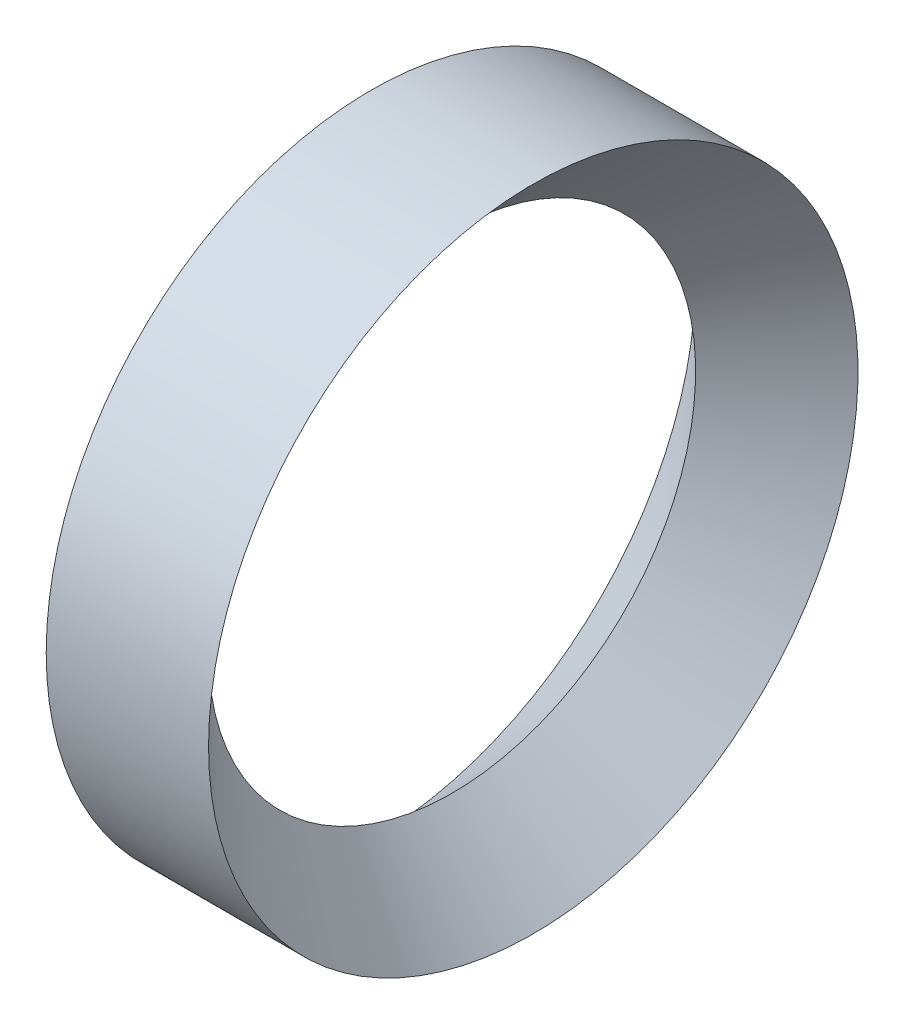
from build123d import *


with BuildPart() as part:
    # 草图1 → 旋转1 (revolve)
    with BuildSketch(Plane.XY, mode=Mode.PRIVATE) as revolve_1_sk:
        Polygon((0, 8), (2, 8), (0, 6), (-2, 8), align=None)
    revolve(revolve_1_sk.sketch.rotate(Axis((-52.339517094, 0, 0), (1, 0, 0)), 90), axis=Axis((-52.339517094, 0, 0), (1, 0, 0)))


solid = part.part
